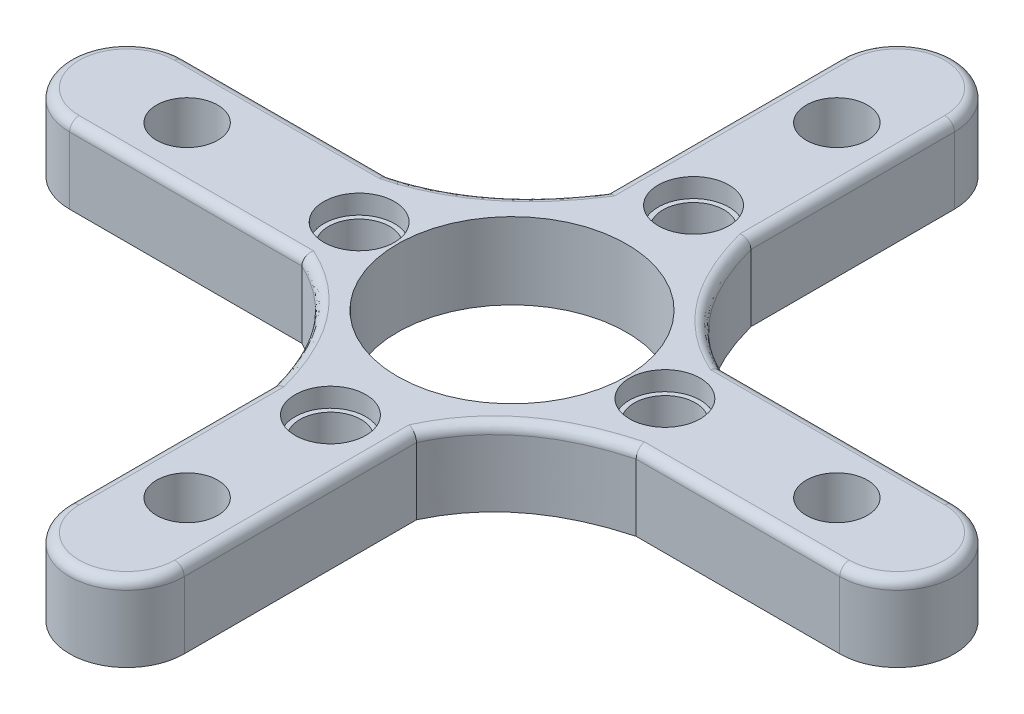
from build123d import *

# Parameters (mm, degrees)
CROQUIS1_R              = 6
CROQUIS1_R_2            = 1.6
SALIENTE_EXTRUIR9_DEPTH = 4
CORTAR_EXTRUIR6_START   = -1
CROQUIS2_R              = 1.85
CROQUIS2_R_2            = 1.6
CORTAR_EXTRUIR6_DEPTH   = 1
REDONDEO1_R             = 0.5


with BuildPart() as part:
    # Croquis1 → Saliente-Extruir9 (new body)
    with BuildSketch(Plane(origin=(0, 0, 0), x_dir=(1, 0, 0), z_dir=(0, 1, 0))):
        with BuildLine():
            Line((-3, 20.151329128), (-3, 8))
            add(Edge.make_bspline(
                [(-9.5, 3), (-5.539409634, 4.06123699), (-3, 8)],
                knots=[0, 0, 0, 1, 1, 1], degree=2))
            Line((-9.5, 3), (-20.151329128, 3))
            ThreePointArc((-20.151329128, 3), (-23.151329128, 0), (-20.151329128, -3))
            Line((-20.151329128, -3), (-8, -3))
            add(Edge.make_bspline(
                [(-3, -9.5), (-3.707491327, -6.859606422), (-5.118438128, -4.343694368), (-8, -3)],
                knots=[0, 0, 0, 0, 1, 1, 1, 1], degree=3))
            Line((-3, -9.5), (-3, -20.151329128))
            ThreePointArc((-3, -20.151329128), (0, -23.151329128), (3, -20.151329128))
            Line((3, -20.151329128), (3, -8))
            add(Edge.make_bspline(
                [(9.5, -3), (6.859606422, -3.707491327), (4.343694368, -5.118438128), (3, -8)],
                knots=[0, 0, 0, 0, 1, 1, 1, 1], degree=3))
            Line((9.5, -3), (20.151329128, -3))
            ThreePointArc((20.151329128, -3), (23.151329128, 0), (20.151329128, 3))
            Line((20.151329128, 3), (8, 3))
            add(Edge.make_bspline(
                [(3, 9.5), (3.707491327, 6.859606422), (5.118438128, 4.343694368), (8, 3)],
                knots=[0, 0, 0, 0, 1, 1, 1, 1], degree=3))
            Line((3, 9.5), (3, 20.151329128))
            ThreePointArc((3, 20.151329128), (0, 23.151329128), (-3, 20.151329128))
        make_face()
        with Locations(Location((0, 0, 0), (0, 0, 270))):
            Circle(CROQUIS1_R, mode=Mode.SUBTRACT)
        with Locations(Location((8, 0, 0), (0, 0, 270))):
            Circle(CROQUIS1_R_2, mode=Mode.SUBTRACT)
        with Locations(Location((0, 9.5, 0), (0, 0, 270))):
            Circle(CROQUIS1_R_2, mode=Mode.SUBTRACT)
        with Locations(Location((-8, 0, 0), (0, 0, 270))):
            Circle(CROQUIS1_R_2, mode=Mode.SUBTRACT)
        with Locations(Location((0, -9.5, 0), (0, 0, 270))):
            Circle(CROQUIS1_R_2, mode=Mode.SUBTRACT)
        with Locations(Location((0, 17, 0), (0, 0, 270))):
            Circle(CROQUIS1_R_2, mode=Mode.SUBTRACT)
        with Locations(Location((17, 0, 0), (0, 0, 270))):
            Circle(CROQUIS1_R_2, mode=Mode.SUBTRACT)
        with Locations(Location((0, -17, 0), (0, 0, 270))):
            Circle(CROQUIS1_R_2, mode=Mode.SUBTRACT)
        with Locations(Location((-17, 0, 0), (0, 0, 270))):
            Circle(CROQUIS1_R_2, mode=Mode.SUBTRACT)
    extrude(amount=SALIENTE_EXTRUIR9_DEPTH)

    # Croquis2 → Cortar-Extruir6 (cut)
    # profile 1 of 4: a face of its own
    with BuildSketch(Plane(origin=(0, 4, 0), x_dir=(1, 0, 0), z_dir=(0, 1, 0)).offset(CORTAR_EXTRUIR6_START)):
        with Locations(Location((0, -9.5, 0), (0, 0, 270))):
            Circle(CROQUIS2_R)
        with Locations(Location((0, -9.5, 0), (0, 0, 270))):
            Circle(CROQUIS2_R_2, mode=Mode.SUBTRACT)
    # profile 2 of 4: a face of its own
    with BuildSketch(Plane(origin=(0, 4, 0), x_dir=(1, 0, 0), z_dir=(0, 1, 0)).offset(CORTAR_EXTRUIR6_START)):
        with Locations(Location((0, 9.5, 0), (0, 0, 270))):
            Circle(CROQUIS2_R)
        with Locations(Location((0, 9.5, 0), (0, 0, 270))):
            Circle(CROQUIS2_R_2, mode=Mode.SUBTRACT)
    # profile 3 of 4: a face of its own
    with BuildSketch(Plane(origin=(0, 4, 0), x_dir=(1, 0, 0), z_dir=(0, 1, 0)).offset(CORTAR_EXTRUIR6_START)):
        with Locations(Location((-8, 0, 0), (0, 0, 270))):
            Circle(CROQUIS2_R)
        with Locations(Location((-8, 0, 0), (0, 0, 270))):
            Circle(CROQUIS2_R_2, mode=Mode.SUBTRACT)
    # profile 4 of 4: a face of its own
    with BuildSketch(Plane(origin=(0, 4, 0), x_dir=(1, 0, 0), z_dir=(0, 1, 0)).offset(CORTAR_EXTRUIR6_START)):
        with Locations(Location((8, 0, 0), (0, 0, 270))):
            Circle(CROQUIS2_R)
        with Locations(Location((8, 0, 0), (0, 0, 270))):
            Circle(CROQUIS2_R_2, mode=Mode.SUBTRACT)
    extrude(amount=CORTAR_EXTRUIR6_DEPTH, mode=Mode.SUBTRACT)

    # Redondeo1
    redondeo1_edges = [part.edges().sort_by_distance(p)[0] for p in [
        (-5.775208287, 4, -4.87389181),
        (-14.825664564, 4, -3),
        (-23.151329128, 4, 0),
        (-14.075664564, 4, 3),
        (-4.75652249, 4, 5.664199077),
        (-3, 4, 14.825664564),
        (0, 4, 23.151329128),
        (3, 4, 14.075664564),
        (5.664199077, 4, 4.75652249),
        (14.825664564, 4, 3),
        (23.151329128, 4, 0),
        (14.075664564, 4, -3),
        (4.75652249, 4, -5.664199077),
        (3, 4, -14.825664564),
        (0, 4, -23.151329128),
        (-3, 4, -14.075664564),
    ]]
    fillet(redondeo1_edges, radius=REDONDEO1_R)


solid = part.part
